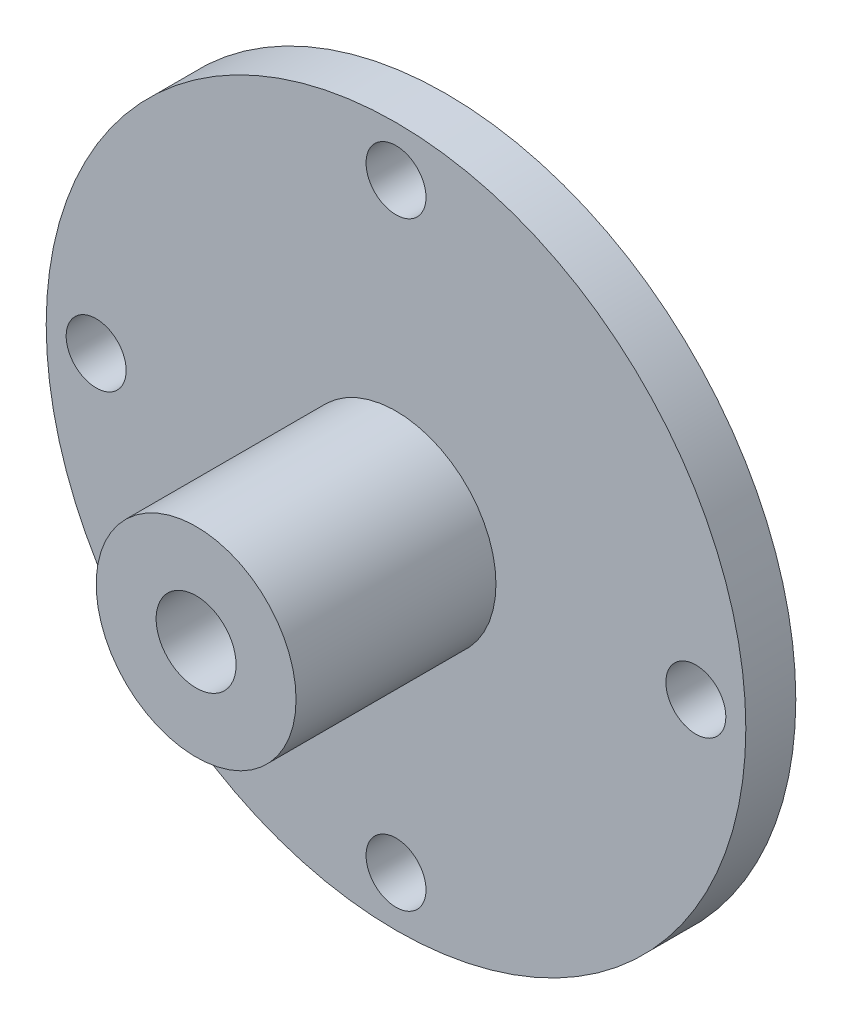
from build123d import *

# Parameters (mm, degrees)
SKETCH1_R           = 35
BOSS_EXTRUDE1_DEPTH = 5
SKETCH4_R           = 3
CUT_EXTRUDE1_DEPTH  = 5
SKETCH5_R           = 10
BOSS_EXTRUDE2_DEPTH = 20
SKETCH6_R           = 4
CUT_EXTRUDE2_DEPTH  = 20


with BuildPart() as part:
    # Sketch1 → Boss-Extrude1 (new body)
    with BuildSketch(Plane.XY):
        Circle(SKETCH1_R)
    extrude(amount=BOSS_EXTRUDE1_DEPTH)

    # Sketch4 → Cut-Extrude1 (cut)
    with BuildSketch(Plane.XY.offset(5)):
        with Locations((0, 30)):
            Circle(SKETCH4_R)
        with Locations((30, 0)):
            Circle(SKETCH4_R)
        with Locations((0, -30)):
            Circle(SKETCH4_R)
        with Locations((-30, 0)):
            Circle(SKETCH4_R)
    extrude(amount=-CUT_EXTRUDE1_DEPTH, mode=Mode.SUBTRACT)

    # Sketch5 → Boss-Extrude2 (add)
    with BuildSketch(Plane.XY.offset(5)):
        Circle(SKETCH5_R)
    extrude(amount=BOSS_EXTRUDE2_DEPTH)

    # Sketch6 → Cut-Extrude2 (cut)
    with BuildSketch(Plane.XY.offset(25)):
        Circle(SKETCH6_R)
    extrude(amount=-CUT_EXTRUDE2_DEPTH, mode=Mode.SUBTRACT)


solid = part.part
